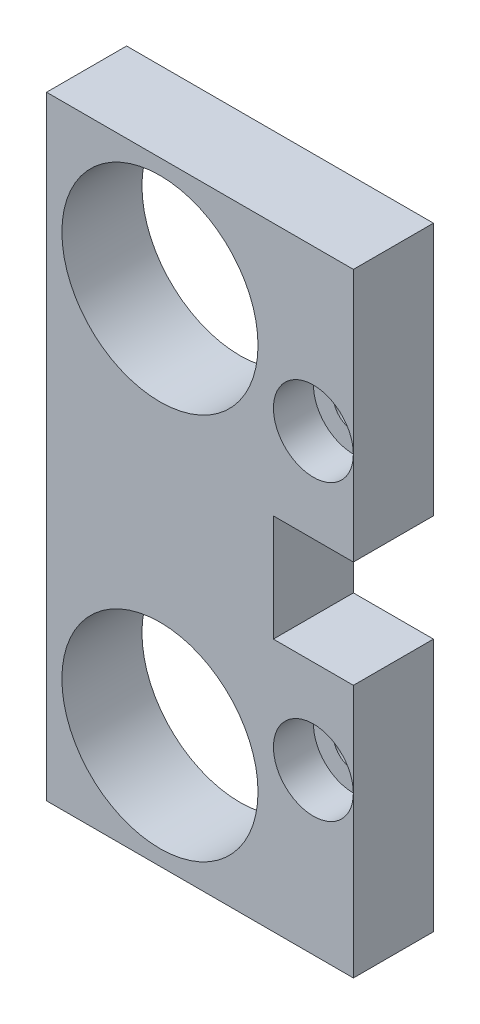
from build123d import *

# Parameters (mm, degrees)
ESQUISSE1_W             = 50
ESQUISSE1_H             = 46
BOSS_EXTRU_2_DEPTH      = 6
ESQUISSE2_W             = 27
ESQUISSE2_H             = 46
ENL_V_MAT_EXTRU_1_DEPTH = 6
ESQUISSE3_R             = 7.35
ENL_V_MAT_EXTRU_2_DEPTH = 6
ESQUISSE4_R             = 1.5
ENL_V_MAT_EXTRU_3_DEPTH = 6
ESQUISSE5_R             = 2.995
ENL_V_MAT_EXTRU_5_DEPTH = 3
ESQUISSE6_W             = 6
ESQUISSE6_H             = 8
ENL_V_MAT_EXTRU_6_DEPTH = 6


with BuildPart() as part:
    # Esquisse1 → Boss.-Extru.2 (new body)
    with BuildSketch(Plane.XY):
        with Locations((25, 23)):
            Rectangle(ESQUISSE1_W, ESQUISSE1_H)
    extrude(amount=BOSS_EXTRU_2_DEPTH)

    # Esquisse2 → Enlèv. mat.-Extru.1 (cut)
    with BuildSketch(Plane.XY.offset(6)):
        with Locations((13.5, 23)):
            Rectangle(ESQUISSE2_W, ESQUISSE2_H)
    extrude(amount=-ENL_V_MAT_EXTRU_1_DEPTH, mode=Mode.SUBTRACT)

    # Esquisse3 → Enlèv. mat.-Extru.2 (cut)
    with BuildSketch(Plane.XY.offset(6)):
        with Locations((35.5, 37.5)):
            Circle(ESQUISSE3_R)
        with Locations((35.5, 8.5)):
            Circle(ESQUISSE3_R)
    extrude(amount=-ENL_V_MAT_EXTRU_2_DEPTH, mode=Mode.SUBTRACT)

    # Esquisse4 → Enlèv. mat.-Extru.3 (cut)
    with BuildSketch(Plane.XY.offset(6)):
        with Locations((47, 34)):
            Circle(ESQUISSE4_R)
        with Locations((47, 12)):
            Circle(ESQUISSE4_R)
    extrude(amount=-ENL_V_MAT_EXTRU_3_DEPTH, mode=Mode.SUBTRACT)

    # Esquisse5 → Enlèv. mat.-Extru.5 (cut)
    with BuildSketch(Plane.XY.offset(6)):
        with Locations((47, 12)):
            Circle(ESQUISSE5_R)
        with Locations((47, 34)):
            Circle(ESQUISSE5_R)
    extrude(amount=-ENL_V_MAT_EXTRU_5_DEPTH, mode=Mode.SUBTRACT)

    # Esquisse6 → Enlèv. mat.-Extru.6 (cut)
    with BuildSketch(Plane.XY.offset(6)):
        with Locations((47, 23)):
            Rectangle(ESQUISSE6_W, ESQUISSE6_H)
    extrude(amount=-ENL_V_MAT_EXTRU_6_DEPTH, mode=Mode.SUBTRACT)


solid = part.part
